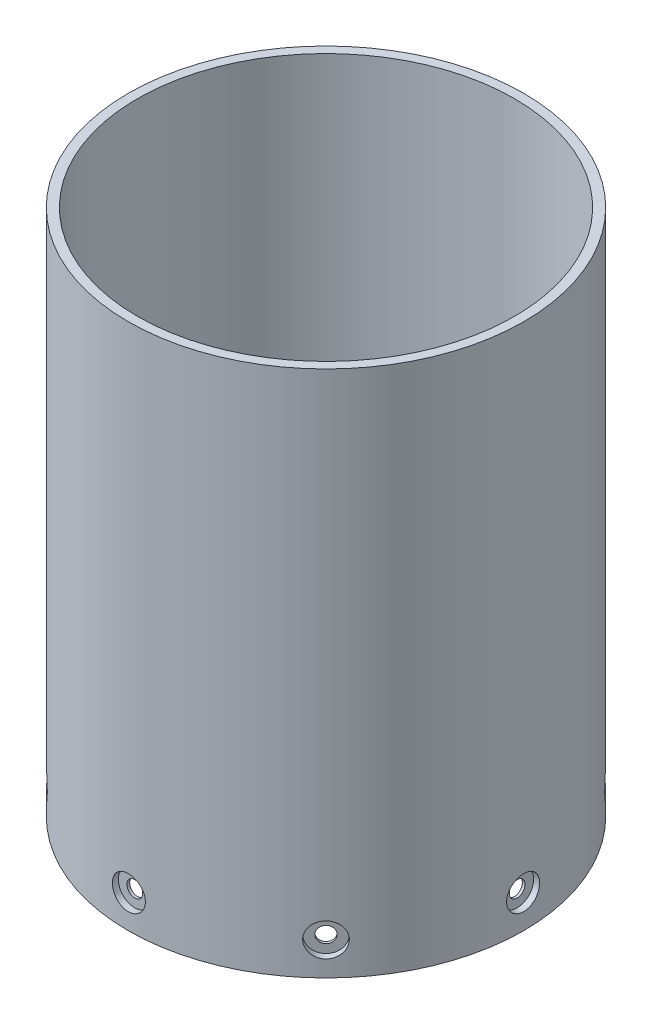
from build123d import *

# Parameters (mm, degrees)
SKETCH_1_R               = 30
SKETCH_1_R_2             = 28.6
EXTRUDE_1_DEPTH          = 80
PATTERN_CIRCULAR_1_COUNT = 8


with BuildPart() as part:
    # 스케치1 → 보스-돌출1 (new body)
    with BuildSketch(Plane(origin=(0, 0, 0), x_dir=(1, 0, 0), z_dir=(0, 1, 0))):
        with Locations(Location((0, 0, 0), (0, 0, 270))):
            Circle(SKETCH_1_R)
        with Locations(Location((0, 0, 0), (0, 0, 270))):
            Circle(SKETCH_1_R_2, mode=Mode.SUBTRACT)
    extrude(amount=EXTRUDE_1_DEPTH)

    # 스케치9 → M2 남비 머리 나사용 카운터보어1 (revolve, cut)
    with BuildSketch(Plane(origin=(-30, 5, 0), x_dir=(0, 0, 1), z_dir=(0, 1, 0))):
        Polygon((0, 0), (0, 10.721032743), (1.2, 10), (1.2, 1), (2.5, 1), (2.5, 0), align=None)
    hole_wizard_m2_1 = revolve(axis=Axis((-36.35, 5, 0), (1, 0, 0)), mode=Mode.SUBTRACT)

    # 원형 패턴1: M2 남비 머리 나사용 카운터보어1 ×8 about axis
    pattern_circular_1_axis = Axis((0, 0, 0), (0, 1, 0))
    for i in range(1, PATTERN_CIRCULAR_1_COUNT):
        add(hole_wizard_m2_1.rotate(pattern_circular_1_axis, i * 360 / PATTERN_CIRCULAR_1_COUNT), mode=Mode.SUBTRACT)


solid = part.part
